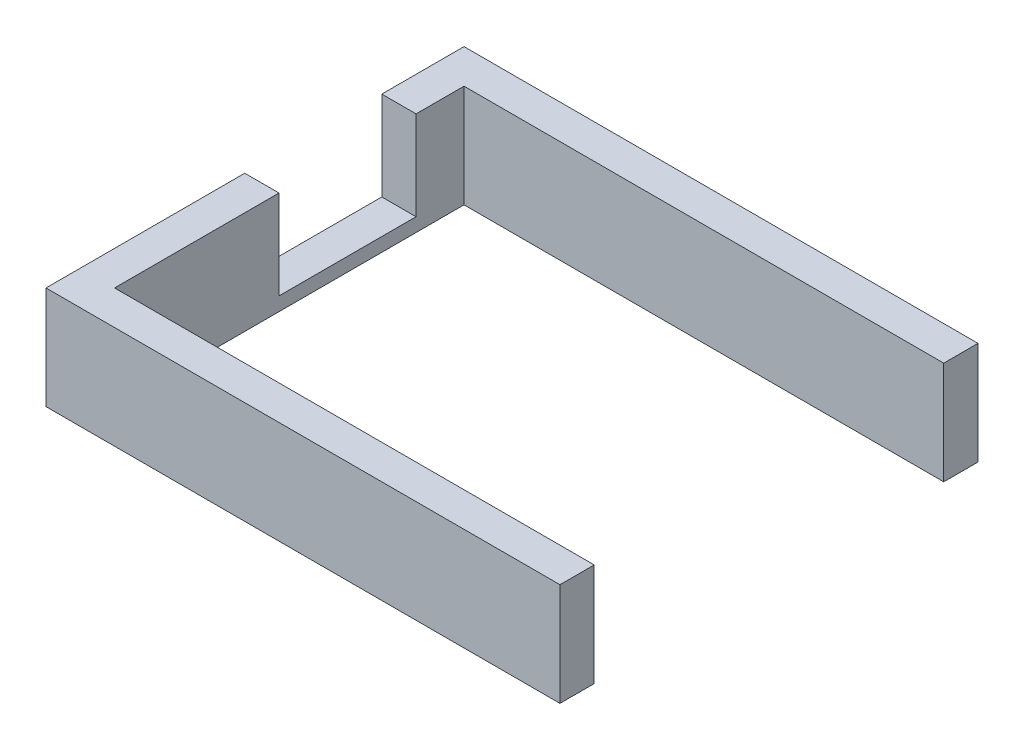
from build123d import *

# Parameters (mm, degrees)
BOSS_EXTRUDE1_DEPTH = 15
SKETCH2_W           = 5
SKETCH2_H           = 20
CUT_EXTRUDE1_DEPTH  = 13


with BuildPart() as part:
    # Sketch1 → Boss-Extrude1 (new body)
    with BuildSketch(Plane(origin=(0, 0, 0), x_dir=(1, 0, 0), z_dir=(0, 1, 0))):
        Polygon((35, -25.5), (35, -30.5), (-40, -30.5), (-40, 30.5), (35, 30.5), (35, 25.5), (-35, 25.5), (-35, -25.5), align=None)
    extrude(amount=BOSS_EXTRUDE1_DEPTH)

    # Sketch2 → Cut-Extrude1 (cut)
    with BuildSketch(Plane(origin=(0, 15, 0), x_dir=(1, 0, 0), z_dir=(0, 1, 0))):
        with Locations((-37.5, 8.5)):
            Rectangle(SKETCH2_W, SKETCH2_H)
    extrude(amount=-CUT_EXTRUDE1_DEPTH, mode=Mode.SUBTRACT)


solid = part.part
